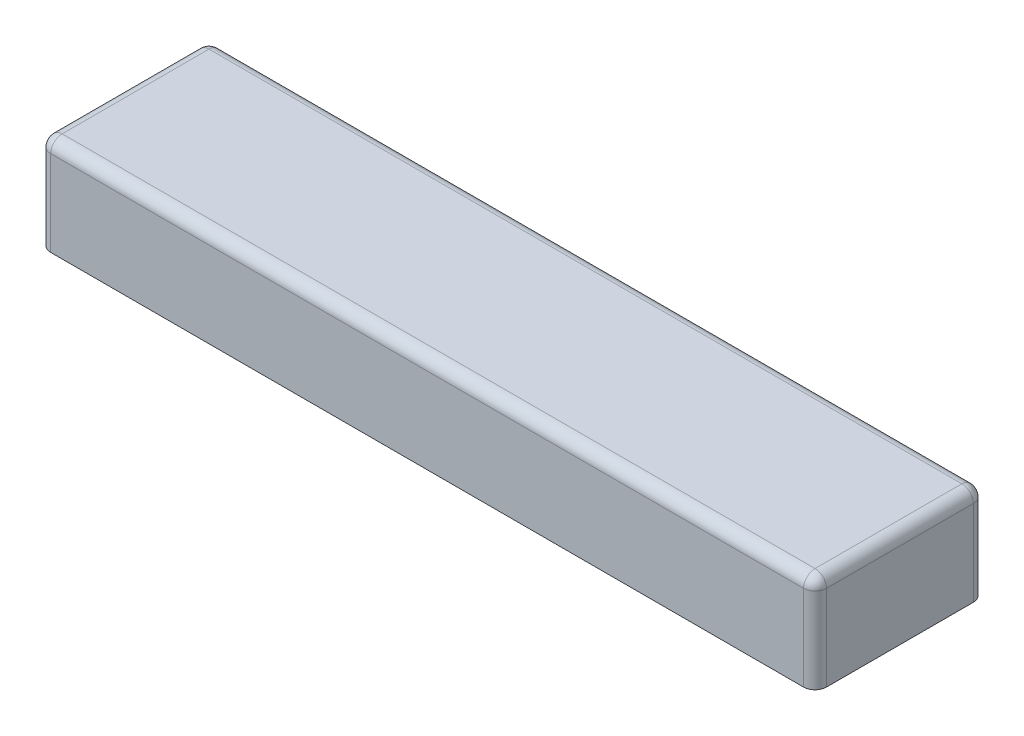
from build123d import *

# Parameters (mm, degrees)
SKETCH1_W           = 203.2
SKETCH1_H           = 44.45
BOSS_EXTRUDE1_DEPTH = 25.4
FILLET1_R           = 3


with BuildPart() as part:
    # Sketch1 → Boss-Extrude1 (new body)
    with BuildSketch(Plane(origin=(0, 0, 0), x_dir=(1, 0, 0), z_dir=(0, 1, 0))):
        with Locations((101.6, 22.225)):
            Rectangle(SKETCH1_W, SKETCH1_H)
    extrude(amount=BOSS_EXTRUDE1_DEPTH)

    # Fillet1
    fillet1_edges = [part.edges().sort_by_distance(p)[0] for p in [
        (203.2, 25.4, -22.225),
        (101.6, 25.4, -44.45),
        (0, 25.4, -22.225),
        (0, 12.7, -44.45),
        (203.2, 12.7, -44.45),
        (203.2, 12.7, 0),
        (0, 12.7, 0),
        (101.6, 25.4, 0),
    ]]
    fillet(fillet1_edges, radius=FILLET1_R)


solid = part.part
